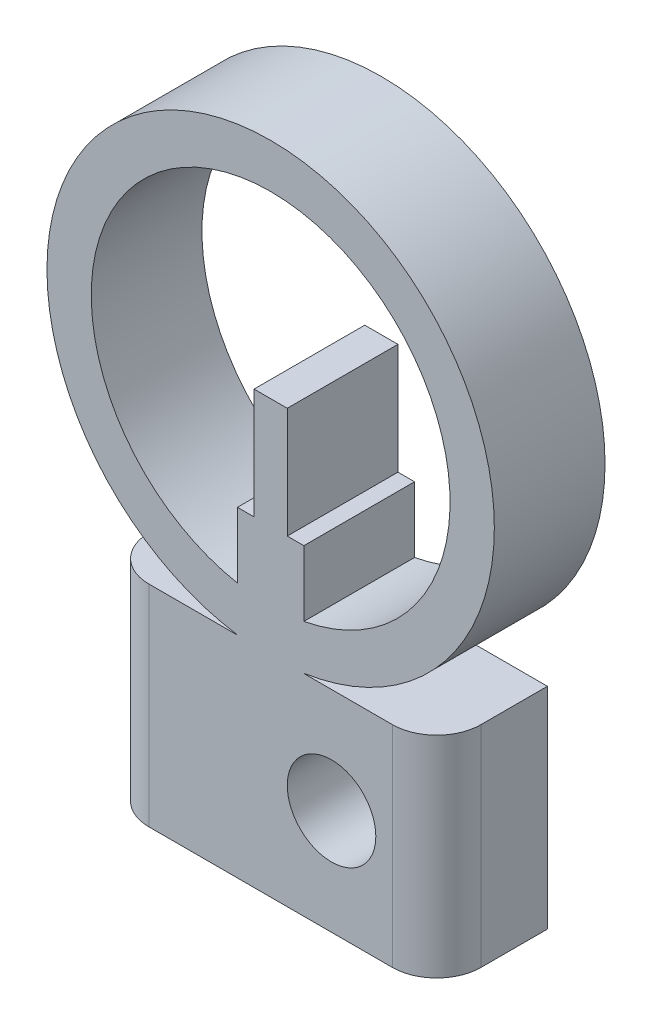
from build123d import *

# Parameters (mm, degrees)
SKETCH1_W               = 15
SKETCH1_H               = 9.5
BOSS_EXTRUDE2_DEPTH     = 5
CUT_EXTRUDE1_DEPTH      = 11.188841936
CUT_EXTRUDE1_DEPTH_BACK = 11.188841936
SKETCH3_R               = 2
SKETCH4_W               = 3
SKETCH4_H               = 5
BOSS_EXTRUDE3_DEPTH     = 5
FILLET1_R               = 2
SKETCH5_W               = 1.5
SKETCH5_H               = 5
BOSS_EXTRUDE4_DEPTH     = 5
SKETCH6_R               = 10.103320079
SKETCH6_R_2             = 8.103320079
BOSS_EXTRUDE5_DEPTH     = 5


with BuildPart() as part:
    # Sketch1 → Boss-Extrude2 (new body)
    with BuildSketch(Plane.XY):
        Rectangle(SKETCH1_W, SKETCH1_H)
    extrude(amount=-BOSS_EXTRUDE2_DEPTH)

    # Sketch3 → Cut-Extrude1 (cut, two sides: drawn at the far end of the back side and taken through both)
    with BuildSketch(Plane.XY.offset(-CUT_EXTRUDE1_DEPTH_BACK)):
        with Locations((2.75, 0)):
            Circle(SKETCH3_R)
    extrude(amount=CUT_EXTRUDE1_DEPTH + CUT_EXTRUDE1_DEPTH_BACK, mode=Mode.SUBTRACT)

    # Sketch4 → Boss-Extrude3 (add)
    with BuildSketch(Plane(origin=(0, 4.75, 0), x_dir=(1, 0, 0), z_dir=(0, 1, 0))):
        with Locations((0, 2.5)):
            Rectangle(SKETCH4_W, SKETCH4_H)
    extrude(amount=BOSS_EXTRUDE3_DEPTH)

    # Fillet1
    fillet1_edges = [part.edges().sort_by_distance(p)[0] for p in [
        (7.5, 0, 0),
        (-7.5, 0, 0),
    ]]
    fillet(fillet1_edges, radius=FILLET1_R)

    # Sketch5 → Boss-Extrude4 (add)
    with BuildSketch(Plane.XY):
        with Locations((0, 12.25)):
            Rectangle(SKETCH5_W, SKETCH5_H)
    extrude(amount=-BOSS_EXTRUDE4_DEPTH)

    # Sketch6 → Boss-Extrude5 (add)
    with BuildSketch(Plane.XY):
        with Locations((0, 14.75)):
            Circle(SKETCH6_R)
        with Locations((0, 14.75)):
            Circle(SKETCH6_R_2, mode=Mode.SUBTRACT)
    extrude(amount=-BOSS_EXTRUDE5_DEPTH)


solid = part.part
